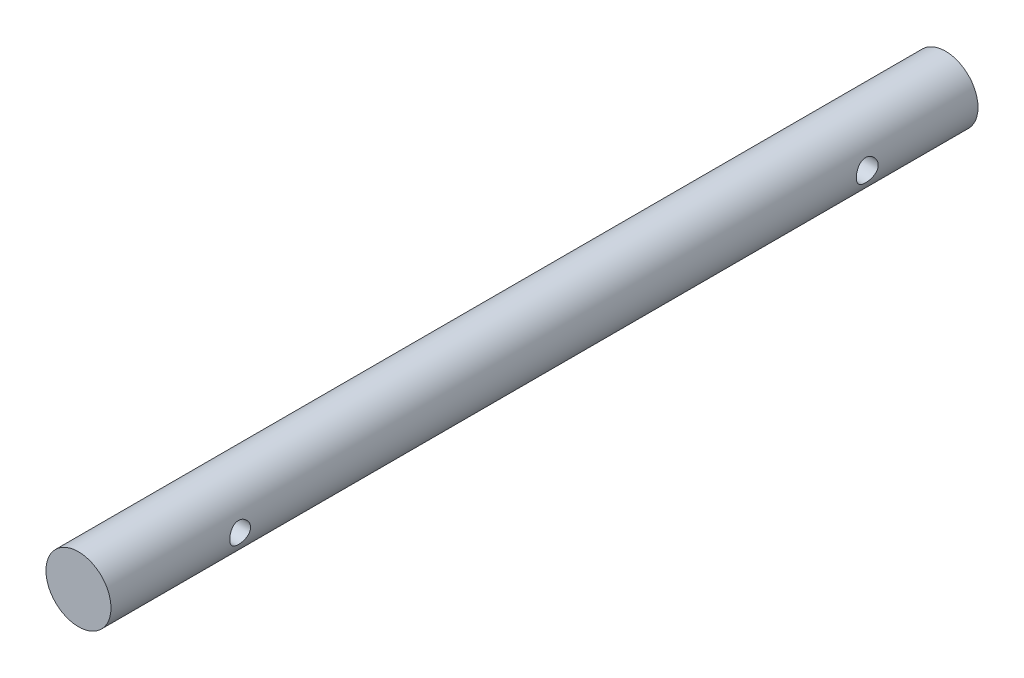
from build123d import *

# Parameters (mm, degrees)
SKETCH1_R               = 2.38125
BOSS_EXTRUDE1_DEPTH     = 31.75
CUT_EXTRUDE3_DEPTH      = 32.928094261
CUT_EXTRUDE3_DEPTH_BACK = 32.928094261
SKETCH4_R               = 0.762
CUT_EXTRUDE4_DEPTH      = 32.928094375
CUT_EXTRUDE4_DEPTH_BACK = 32.928094375
SKETCH5_R               = 0.8001


with BuildPart() as part:
    # Sketch1 → Boss-Extrude1 (new, symmetric)
    with BuildSketch(Plane.XY):
        Circle(SKETCH1_R)
    extrude(amount=BOSS_EXTRUDE1_DEPTH, both=True)

    # Sketch4 → Cut-Extrude3 (cut, two sides: drawn at the far end of the back side and taken through both)
    with BuildSketch(Plane(origin=(0, 0, 0), x_dir=(0, 0, -1), z_dir=(1, 0, 0)).offset(-CUT_EXTRUDE3_DEPTH_BACK)):
        with Locations((-22.2885, 0)):
            Circle(SKETCH4_R)
    extrude(amount=CUT_EXTRUDE3_DEPTH + CUT_EXTRUDE3_DEPTH_BACK, mode=Mode.SUBTRACT)

    # Sketch5 → Cut-Extrude4 (cut, two sides: drawn at the far end of the back side and taken through both)
    with BuildSketch(Plane(origin=(0, 0, 0), x_dir=(0, 0, -1), z_dir=(1, 0, 0)).offset(-CUT_EXTRUDE4_DEPTH_BACK)):
        with Locations((23.641617285, 0)):
            Circle(SKETCH5_R)
    extrude(amount=CUT_EXTRUDE4_DEPTH + CUT_EXTRUDE4_DEPTH_BACK, mode=Mode.SUBTRACT)


solid = part.part
